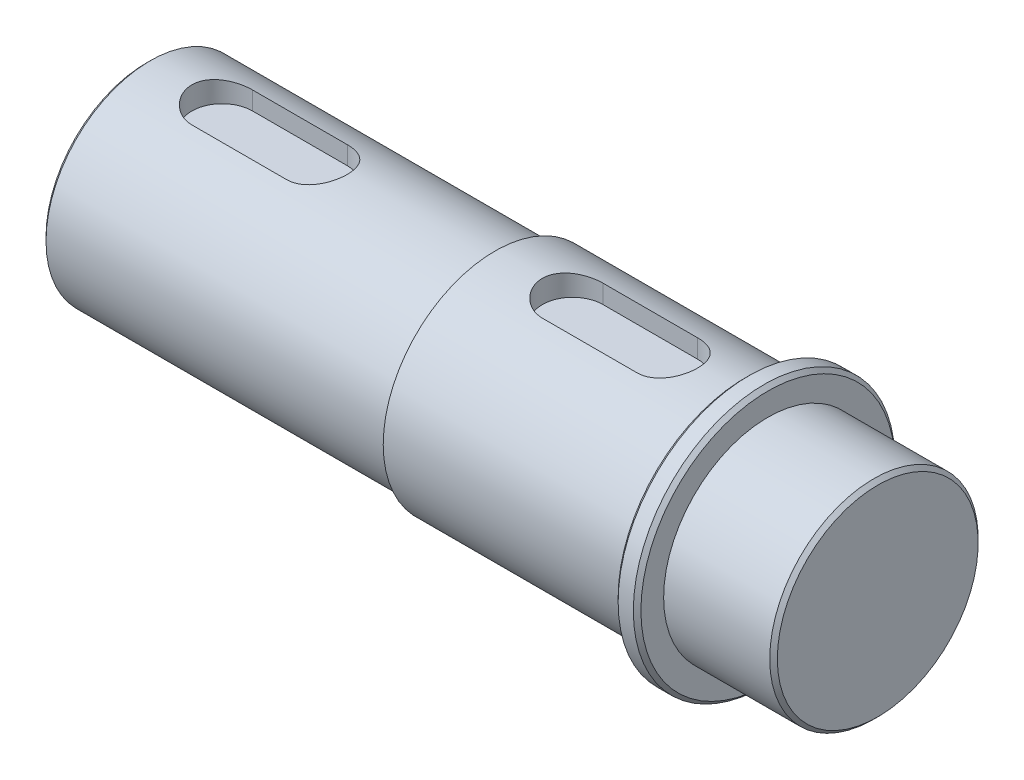
from build123d import *

# Parameters (mm, degrees)
CUT_EXTRUDE1_DEPTH  = 6
SKETCH3_R           = 27.5
BOSS_EXTRUDE1_DEPTH = 63
CHAMFER1_SIZE       = 1
CUT_EXTRUDE2_DEPTH  = 6


with BuildPart() as part:
    # Sketch1 → Revolve1 (revolve)
    with BuildSketch(Plane.XY, mode=Mode.PRIVATE) as revolve1_sk:
        Polygon((-59.649564477, 0), (-59.649564477, 27.5), (-30.659969427, 27.5), (-30.659969427, 29.5), (35.33203125, 29.5), (35.33203125, 33.5), (36.33203125, 34.5), (40.340030573, 34.5), (41.340030573, 33.5), (41.340030573, 27.5), (69.340030573, 27.5), (70.340030573, 26.5), (70.340030573, 0), align=None)
    revolve(revolve1_sk.sketch.rotate(Axis((-72.236328125, 0, 0), (1, 0, 0)), 90), axis=Axis((-72.236328125, 0, 0), (1, 0, 0)))

    # Sketch2 → Cut-Extrude1 (cut)
    with BuildSketch(Plane(origin=(0, 29.5, 0), x_dir=(1, 0, 0), z_dir=(0, 1, 0))):
        with BuildLine():
            Line((-10.16796875, 8), (14.83203125, 8))
            ThreePointArc((14.83203125, 8), (22.83203125, 0), (14.83203125, -8))
            Line((14.83203125, -8), (-10.16796875, -8))
            ThreePointArc((-10.16796875, -8), (-18.16796875, 0), (-10.16796875, 8))
        make_face()
    extrude(amount=-CUT_EXTRUDE1_DEPTH, mode=Mode.SUBTRACT)

    # Sketch3 → Boss-Extrude1 (add)
    with BuildSketch(Plane.ZY.offset(59.649564477)):
        Circle(SKETCH3_R)
    extrude(amount=BOSS_EXTRUDE1_DEPTH)

    # Chamfer1
    chamfer1_edges = [part.edges().sort_by_distance(p)[0] for p in [
        (-122.649564477, 0, -27.5),
    ]]
    chamfer(chamfer1_edges, length=CHAMFER1_SIZE)

    # Sketch4 → Cut-Extrude2 (cut)
    with BuildSketch(Plane(origin=(0, 27.5, 0), x_dir=(1, 0, 0), z_dir=(0, 1, 0))):
        with BuildLine():
            Line((-102.649564477, 8), (-77.649564477, 8))
            ThreePointArc((-77.649564477, 8), (-69.649564477, 0), (-77.649564477, -8))
            Line((-77.649564477, -8), (-102.649564477, -8))
            ThreePointArc((-102.649564477, -8), (-110.649564477, 0), (-102.649564477, 8))
        make_face()
    extrude(amount=-CUT_EXTRUDE2_DEPTH, mode=Mode.SUBTRACT)


solid = part.part
